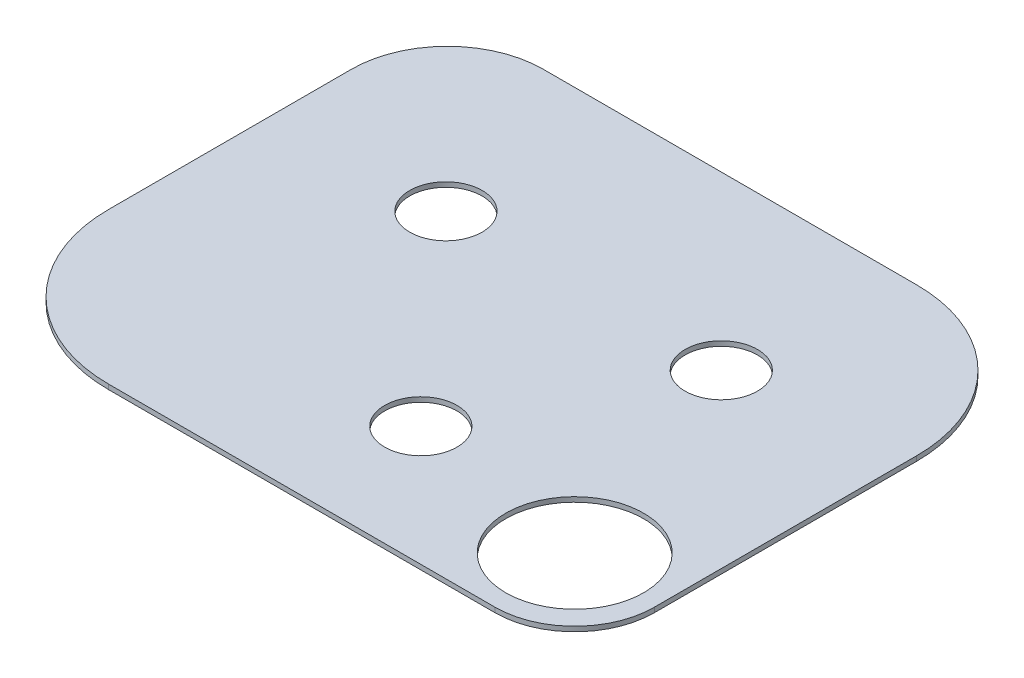
from build123d import *

# Parameters (mm, degrees)
SKETCH1_W           = 128
SKETCH1_H           = 101.6
BOSS_EXTRUDE1_DEPTH = 1
CUT_EXTRUDE1_DEPTH  = 1
SKETCH3_R           = 14.3
SKETCH3_R_2         = 7.5
CUT_EXTRUDE2_DEPTH  = 1


with BuildPart() as part:
    # Sketch1 → Boss-Extrude1 (new body)
    with BuildSketch(Plane(origin=(0, 0, 0), x_dir=(1, 0, 0), z_dir=(0, 1, 0))):
        Rectangle(SKETCH1_W, SKETCH1_H)
    extrude(amount=BOSS_EXTRUDE1_DEPTH)

    # Sketch2 → Cut-Extrude1 (cut)
    with BuildSketch(Plane(origin=(0, 1, 0), x_dir=(1, 0, 0), z_dir=(0, 1, 0))):
        with BuildLine():
            Line((-64, -50.8), (-64, -19.42235648))
            ThreePointArc((-64, -19.42235648), (-54.809700991, -41.609700991), (-32.62235648, -50.8))
            Line((-32.62235648, -50.8), (-64, -50.8))
        make_face()
        with BuildLine():
            Line((47.49, -50.8), (64, -50.8))
            Line((64, -50.8), (64, -34.29))
            ThreePointArc((64, -34.29), (59.164332957, -45.964332957), (47.49, -50.8))
        make_face()
        with BuildLine():
            Line((-64, 30.923649501), (-64, 50.8))
            Line((-64, 50.8), (-44.123649501, 50.8))
            ThreePointArc((-44.123649501, 50.8), (-58.178351724, 44.978351724), (-64, 30.923649501))
        make_face()
        with BuildLine():
            Line((64, 20.116458758), (64, 50.8))
            Line((64, 50.8), (33.316458758, 50.8))
            ThreePointArc((33.316458758, 50.8), (55.012998841, 41.812998841), (64, 20.116458758))
        make_face()
    extrude(amount=-CUT_EXTRUDE1_DEPTH, mode=Mode.SUBTRACT)

    # Sketch3 → Cut-Extrude2 (cut)
    with BuildSketch(Plane(origin=(0, 1, 0), x_dir=(1, 0, 0), z_dir=(0, 1, 0))):
        with Locations(Location((46, -32.8, 0), (0, 0, 270))):
            Circle(SKETCH3_R)
        with Locations(Location((7.3, -26, 0), (0, 0, 270))):
            Circle(SKETCH3_R_2)
        with Locations(Location((-28.7, 15.2, 0), (0, 0, 270))):
            Circle(SKETCH3_R_2)
        with Locations(Location((28.4, 15.2, 0), (0, 0, 270))):
            Circle(SKETCH3_R_2)
    extrude(amount=-CUT_EXTRUDE2_DEPTH, mode=Mode.SUBTRACT)


solid = part.part
